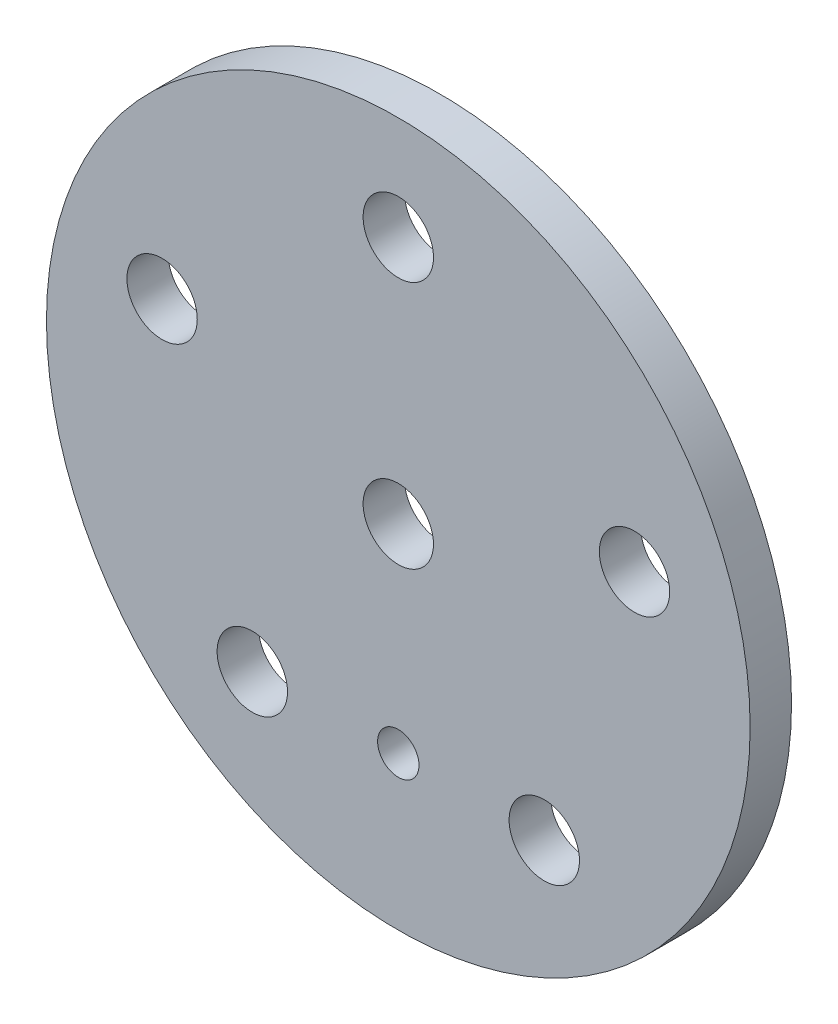
from build123d import *

# Parameters (mm, degrees)
SKETCH1_R           = 85
SKETCH1_R_2         = 8.5
BOSS_EXTRUDE1_DEPTH = 10
SKETCH2_R           = 8.5
CUT_EXTRUDE1_DEPTH  = 10
SKETCH4_R           = 5
CUT_EXTRUDE3_DEPTH  = 60


with BuildPart() as part:
    # Sketch1 → Boss-Extrude1 (new body)
    with BuildSketch(Plane.XY):
        Circle(SKETCH1_R)
        Circle(SKETCH1_R_2, mode=Mode.SUBTRACT)
    extrude(amount=BOSS_EXTRUDE1_DEPTH)

    # Sketch2 → Cut-Extrude1 (cut)
    with BuildSketch(Plane.XY.offset(10)):
        with Locations((0, 60)):
            Circle(SKETCH2_R)
        with Locations((57.063390978, 18.541019662)):
            Circle(SKETCH2_R)
        with Locations((35.267115138, -48.541019662)):
            Circle(SKETCH2_R)
        with Locations((-35.267115138, -48.541019662)):
            Circle(SKETCH2_R)
        with Locations((-57.063390978, 18.541019662)):
            Circle(SKETCH2_R)
    extrude(amount=-CUT_EXTRUDE1_DEPTH, mode=Mode.SUBTRACT)

    # Sketch4 → Cut-Extrude3 (cut)
    with BuildSketch(Plane.XY.offset(10)):
        with Locations((0, -48)):
            Circle(SKETCH4_R)
    extrude(amount=-CUT_EXTRUDE3_DEPTH, mode=Mode.SUBTRACT)


solid = part.part
